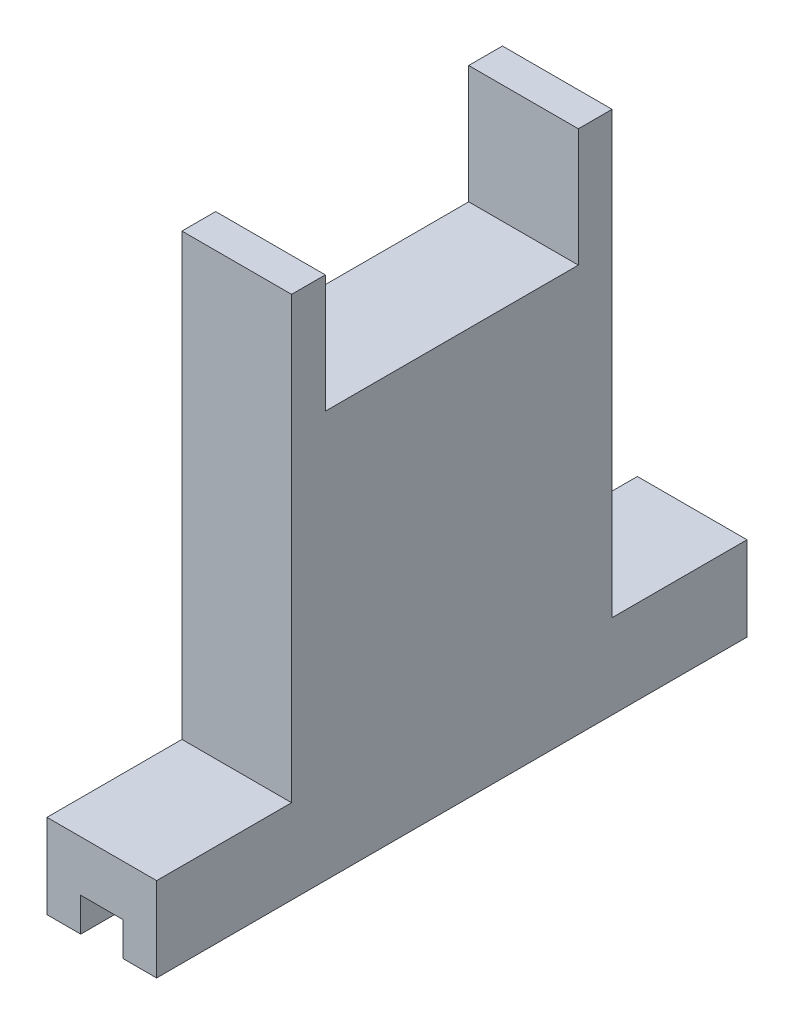
from build123d import *

# Parameters (mm, degrees)
SKETCH_2_W          = 6.5
SKETCH_2_H          = 35
EXTRUDE_1_DEPTH     = 5
SKETCH_3_W          = 2.5
SKETCH_3_H          = 2
CUT_EXTRUDE_1_DEPTH = 180
SKETCH_4_W          = 6.5
SKETCH_4_H          = 19
EXTRUDE_2_DEPTH     = 26.1
SKETCH_5_W          = 6.5
SKETCH_5_H          = 15
CUT_EXTRUDE_2_DEPTH = 7


with BuildPart() as part:
    # Эскиз2 → Бобышка-Вытянуть1 (new body)
    with BuildSketch(Plane(origin=(0, 0, 0), x_dir=(1, 0, 0), z_dir=(0, 1, 0))):
        with Locations((-86.667897916, 21.515984643)):
            Rectangle(SKETCH_2_W, SKETCH_2_H)
    extrude(amount=EXTRUDE_1_DEPTH)

    # Эскиз3 → Вырез-Вытянуть1 (cut)
    with BuildSketch(Plane.XY.offset(-4.015984643)):
        with Locations((-86.667897916, 1)):
            Rectangle(SKETCH_3_W, SKETCH_3_H)
    extrude(amount=-CUT_EXTRUDE_1_DEPTH, mode=Mode.SUBTRACT)

    # Эскиз4 → Бобышка-Вытянуть2 (add)
    with BuildSketch(Plane(origin=(0, 5, 0), x_dir=(1, 0, 0), z_dir=(0, 1, 0))):
        with Locations((-86.667897916, 21.515984643)):
            Rectangle(SKETCH_4_W, SKETCH_4_H)
    extrude(amount=EXTRUDE_2_DEPTH)

    # Эскиз5 → Вырез-Вытянуть2 (cut)
    with BuildSketch(Plane(origin=(0, 31.1, 0), x_dir=(1, 0, 0), z_dir=(0, 1, 0))):
        with Locations((-86.667897916, 21.515984643)):
            Rectangle(SKETCH_5_W, SKETCH_5_H)
    extrude(amount=-CUT_EXTRUDE_2_DEPTH, mode=Mode.SUBTRACT)


solid = part.part
